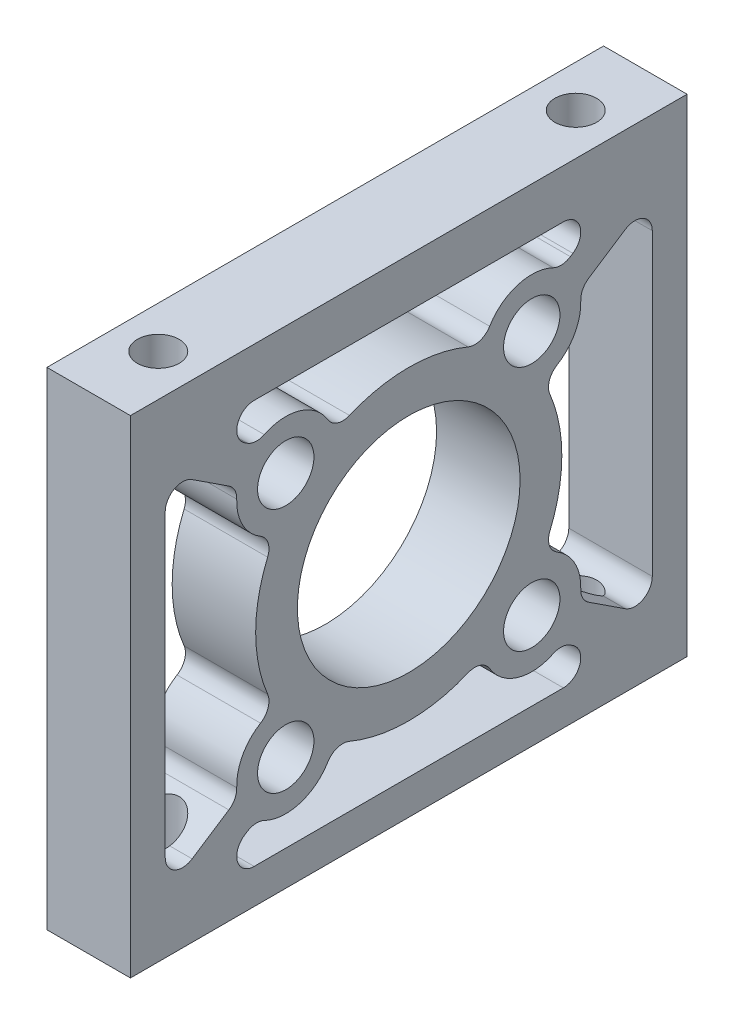
from build123d import *

# Parameters (mm, degrees)
SKETCH_1_W          = 40
SKETCH_1_H          = 34
SKETCH_1_R          = 2.025
SKETCH_1_R_2        = 7
EXTRUDE_1_DEPTH     = 6
CUT_EXTRUDE_1_DEPTH = 8
FILLET_2_R          = 1.25
SKETCH_4_R          = 1.5
CUT_EXTRUDE_2_DEPTH = 40.899874837
EXTRUDE_START       = 1
SKETCH_5_W          = 6
SKETCH_5_H          = 40
SKETCH_5_R          = 1.5
EXTRUDE_2_DEPTH     = 1
SKETCH_6_R          = 8
CUT_EXTRUDE_3_DEPTH = 28.568097664


with BuildPart() as part:
    # 草图1 → 凸台-拉伸1 (new body)
    with BuildSketch(Plane(origin=(0, 0, 0), x_dir=(0, 0, -1), z_dir=(1, 0, 0))):
        Rectangle(SKETCH_1_W, SKETCH_1_H)
        with Locations((-8.838834765, 8.838834765)):
            Circle(SKETCH_1_R, mode=Mode.SUBTRACT)
        with Locations((8.838834765, 8.838834765)):
            Circle(SKETCH_1_R, mode=Mode.SUBTRACT)
        with Locations((8.838834765, -8.838834765)):
            Circle(SKETCH_1_R, mode=Mode.SUBTRACT)
        with Locations((-8.838834765, -8.838834765)):
            Circle(SKETCH_1_R, mode=Mode.SUBTRACT)
        Circle(SKETCH_1_R_2, mode=Mode.SUBTRACT)
    extrude(amount=EXTRUDE_1_DEPTH)

    # 草图2 → 切除-拉伸1 (cut)
    with BuildSketch(Plane(origin=(6, 0, 0), x_dir=(0, 0, -1), z_dir=(1, 0, 0))):
        with BuildLine():
            Line((-12.26975842, 9.647777205), (-17.5, 13.066400566))
            Line((-17.5, 13.066400566), (-17.5, -13.066400566))
            Line((-17.5, -13.066400566), (-12.26975842, -9.647777205))
            ThreePointArc((-12.26975842, -9.647777205), (-11.820273909, -6.958237617), (-9.586656497, -5.394072414))
            ThreePointArc((-9.586656497, -5.394072414), (-11, 0), (-9.586656497, 5.394072414))
            ThreePointArc((-9.586656497, 5.394072414), (-11.820273909, 6.958237617), (-12.26975842, 9.647777205))
        make_face()
        with BuildLine():
            Line((15.30669861, 14.5), (-15.30669861, 14.5))
            Line((-15.30669861, 14.5), (-10.956669387, 11.65670657))
            ThreePointArc((-10.956669387, 11.65670657), (-7.609419812, 12.142493929), (-5.394072414, 9.586656497))
            ThreePointArc((-5.394072414, 9.586656497), (0, 11), (5.394072414, 9.586656497))
            ThreePointArc((5.394072414, 9.586656497), (7.609419812, 12.142493929), (10.956669387, 11.65670657))
            Line((10.956669387, 11.65670657), (15.30669861, 14.5))
        make_face()
        with BuildLine():
            Line((17.5, -13.066400566), (17.5, 13.066400566))
            Line((17.5, 13.066400566), (12.26975842, 9.647777205))
            ThreePointArc((12.26975842, 9.647777205), (12.34023669, 9.246031962), (12.363834765, 8.838834765))
            ThreePointArc((12.363834765, 8.838834765), (11.583073877, 6.626420541), (9.586656497, 5.394072414))
            ThreePointArc((9.586656497, 5.394072414), (10.640799347, 2.788079853), (11, 0))
            ThreePointArc((11, 0), (10.640799347, -2.788079853), (9.586656497, -5.394072414))
            ThreePointArc((9.586656497, -5.394072414), (11.583073877, -6.626420541), (12.363834765, -8.838834765))
            ThreePointArc((12.363834765, -8.838834765), (12.34023669, -9.246031962), (12.26975842, -9.647777205))
            Line((12.26975842, -9.647777205), (17.5, -13.066400566))
        make_face()
        with BuildLine():
            Line((-10.956669387, -11.65670657), (-15.30669861, -14.5))
            Line((-15.30669861, -14.5), (15.30669861, -14.5))
            Line((15.30669861, -14.5), (10.956669387, -11.65670657))
            ThreePointArc((10.956669387, -11.65670657), (7.609419812, -12.142493929), (5.394072414, -9.586656497))
            ThreePointArc((5.394072414, -9.586656497), (0, -11), (-5.394072414, -9.586656497))
            ThreePointArc((-5.394072414, -9.586656497), (-7.609419812, -12.142493929), (-10.956669387, -11.65670657))
        make_face()
    extrude(amount=-CUT_EXTRUDE_1_DEPTH, mode=Mode.SUBTRACT)

    # 圆角2
    fillet_2_edges = [part.edges().sort_by_distance(p)[0] for p in [
        (3, -5.394072414, -9.586656497),
        (3, 5.394072414, -9.586656497),
        (3, 9.647777205, -12.26975842),
        (3, 13.066400566, -17.5),
        (3, -13.066400566, -17.5),
        (3, -9.647777205, -12.26975842),
        (3, 9.586656497, -5.394072414),
        (3, 9.586656497, 5.394072414),
        (3, 11.65670657, 10.956669387),
        (3, 14.5, 15.30669861),
        (3, 14.5, -15.30669861),
        (3, 11.65670657, -10.956669387),
        (3, -9.586656497, 5.394072414),
        (3, -9.586656497, -5.394072414),
        (3, -11.65670657, -10.956669387),
        (3, -14.5, -15.30669861),
        (3, -14.5, 15.30669861),
        (3, -11.65670657, 10.956669387),
        (3, 5.394072414, 9.586656497),
        (3, -5.394072414, 9.586656497),
        (3, -9.647777205, 12.26975842),
        (3, -13.066400566, 17.5),
        (3, 13.066400566, 17.5),
        (3, 9.647777205, 12.26975842),
    ]]
    fillet(fillet_2_edges, radius=FILLET_2_R)

    # 草图4 → 切除-拉伸2 (cut, through all)
    with BuildSketch(Plane(origin=(0, 17, 0), x_dir=(1, 0, 0), z_dir=(0, 1, 0))):
        with Locations(Location((3, 15, 0), (0, 0, 270))):
            Circle(SKETCH_4_R)
        with Locations(Location((3, -15, 0), (0, 0, 202.172707321))):
            Circle(SKETCH_4_R)
    extrude(amount=-CUT_EXTRUDE_2_DEPTH, mode=Mode.SUBTRACT)

    # 草图5 → 凸台-拉伸2 (add)
    with BuildSketch(Plane(origin=(0, 17, 0), x_dir=(1, 0, 0), z_dir=(0, 1, 0)).offset(EXTRUDE_START)):
        with Locations((3, 0)):
            Rectangle(SKETCH_5_W, SKETCH_5_H)
        with Locations(Location((3, -15, 0), (0, 0, 202.172707321))):
            Circle(SKETCH_5_R, mode=Mode.SUBTRACT)
        with Locations(Location((3, 15, 0), (0, 0, 270))):
            Circle(SKETCH_5_R, mode=Mode.SUBTRACT)
    extrude(amount=-EXTRUDE_2_DEPTH)

    # 草图6 → 切除-拉伸3 (cut, through all)
    with BuildSketch(Plane(origin=(6, 0, 0), x_dir=(0, 0, -1), z_dir=(1, 0, 0))):
        Circle(SKETCH_6_R)
    extrude(amount=-CUT_EXTRUDE_3_DEPTH, mode=Mode.SUBTRACT)


solid = part.part
